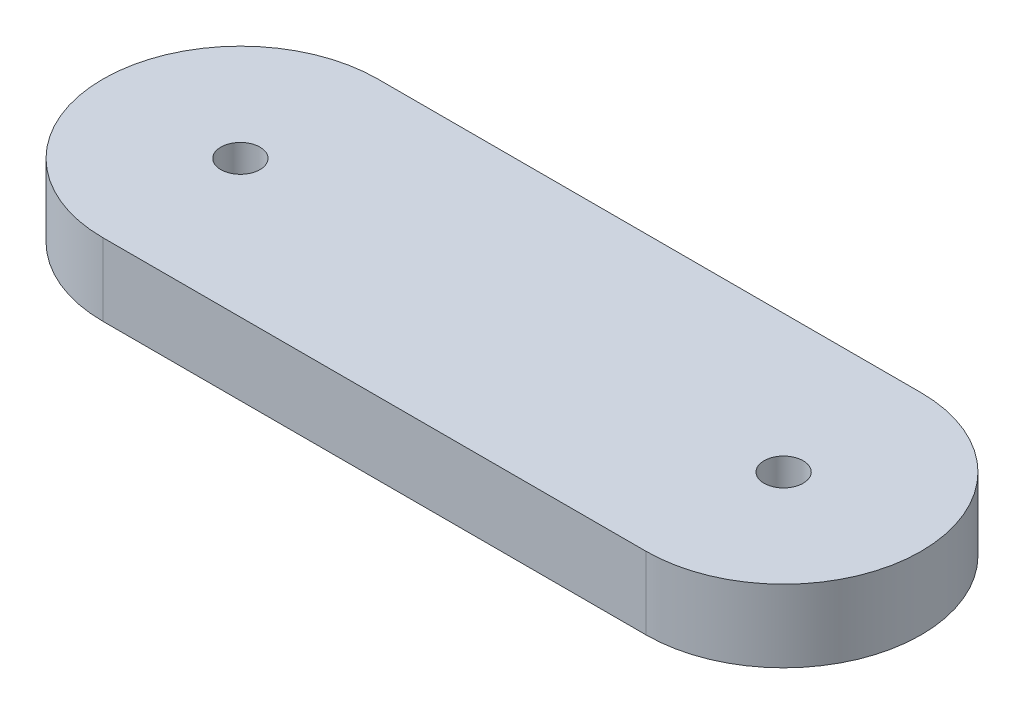
from build123d import *

# Parameters (mm, degrees)
SKETCH1_R           = 2.7
BOSS_EXTRUDE1_DEPTH = 10


with BuildPart() as part:
    # Sketch1 → Boss-Extrude1 (new body)
    with BuildSketch(Plane(origin=(0, 0, 0), x_dir=(1, 0, 0), z_dir=(0, 1, 0))):
        with BuildLine():
            Line((0, -18.977178488), (75, -18.977178488))
            ThreePointArc((75, -18.977178488), (93.977178488, 0), (75, 18.977178488))
            Line((75, 18.977178488), (0, 18.977178488))
            ThreePointArc((0, 18.977178488), (-18.977178488, 0), (0, -18.977178488))
        make_face()
        with Locations(Location((75, 0, 0), (0, 0, 270))):
            Circle(SKETCH1_R, mode=Mode.SUBTRACT)
        with Locations(Location((0, 0, 0), (0, 0, 270))):
            Circle(SKETCH1_R, mode=Mode.SUBTRACT)
    extrude(amount=BOSS_EXTRUDE1_DEPTH)


solid = part.part
